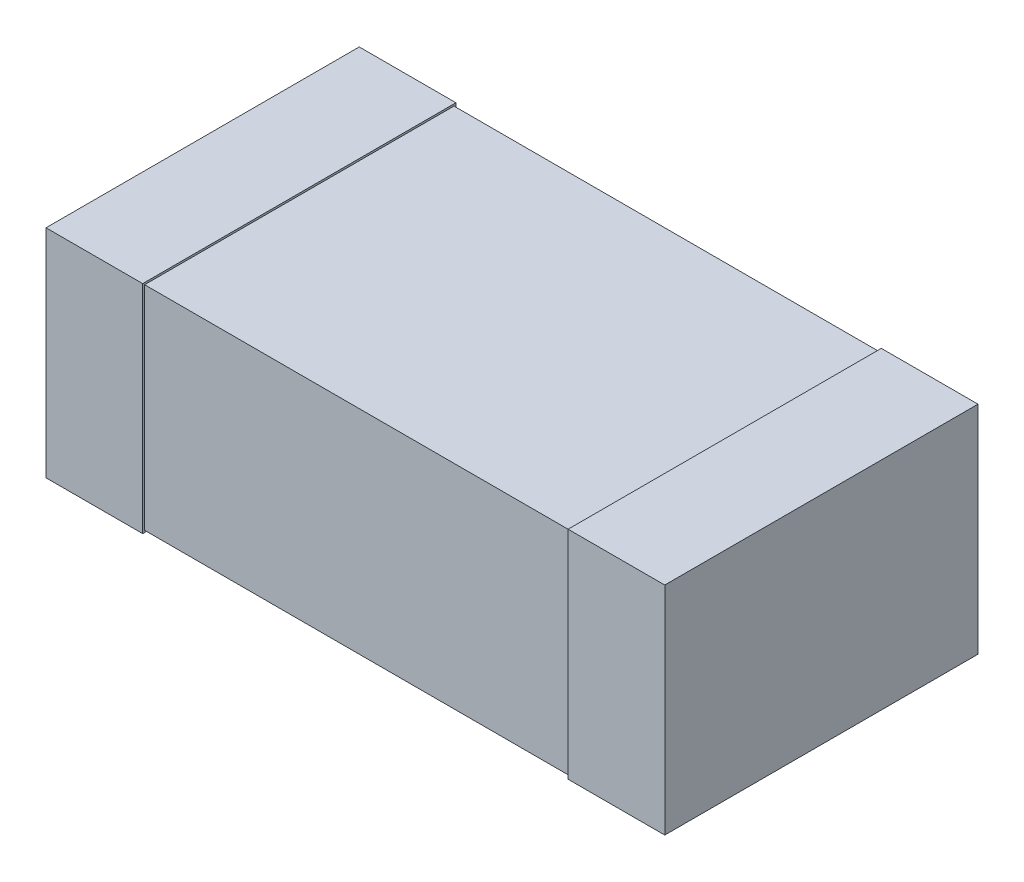
from build123d import *

# Parameters (mm, degrees)
SKETCH_1_W      = 3.2
SKETCH_1_H      = 1.6
EXTRUDE_1_DEPTH = 1.1
SKETCH_2_W      = 1.62
SKETCH_2_H      = 1.12
EXTRUDE_2_DEPTH = 0.5


with BuildPart() as part:
    # 草图1 → 凸台-拉伸1 (new body)
    with BuildSketch(Plane(origin=(0, 0, 0), x_dir=(1, 0, 0), z_dir=(0, 1, 0))):
        Rectangle(SKETCH_1_W, SKETCH_1_H)
    extrude(amount=EXTRUDE_1_DEPTH)

    # 草图2 → 凸台-拉伸2 (add)
    with BuildSketch(Plane.ZY.offset(1.6)):
        with Locations((0, 0.55)):
            Rectangle(SKETCH_2_W, SKETCH_2_H)
    extrude_2 = extrude(amount=-EXTRUDE_2_DEPTH)

    # 镜向1: 凸台-拉伸2 across plane
    add(extrude_2.mirror(Plane(origin=(0, 0, 0), x_dir=(0, 0, 1), z_dir=(1, 0, 0))))


solid = part.part
